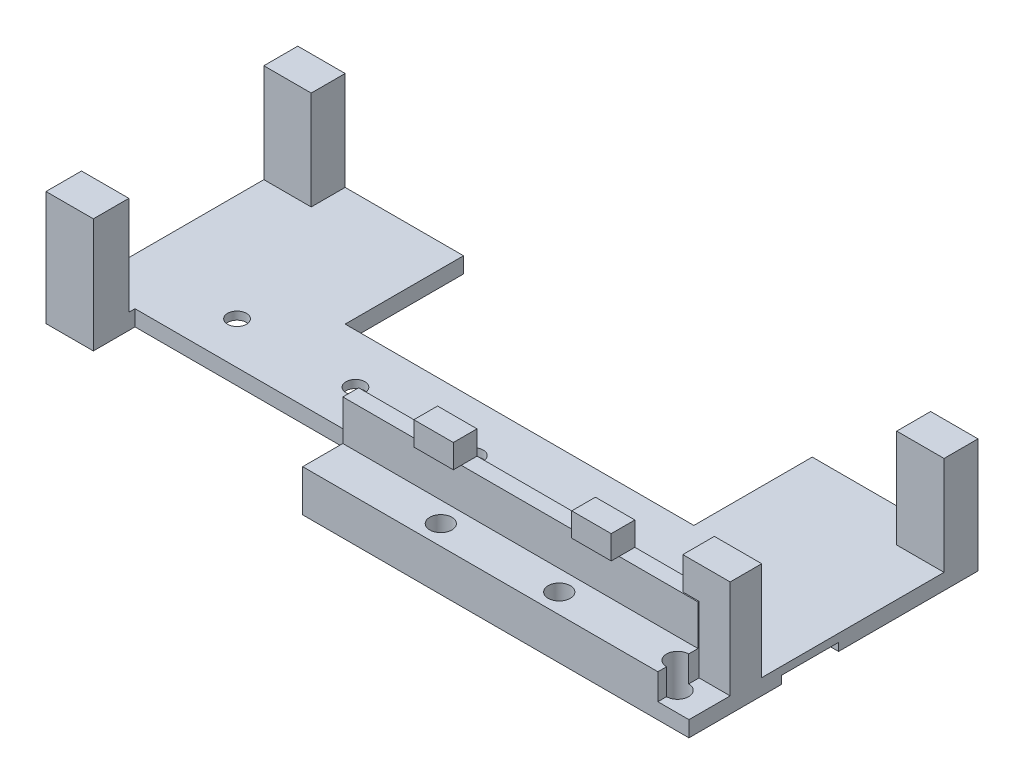
from build123d import *

# Parameters (mm, degrees)
EXTRUDE_1_DEPTH           = 2
CUT_EXTRUDE_1_DEPTH       = 2
SKETCH_3_W                = 3
SKETCH_3_H                = 3
EXTRUDE_2_DEPTH           = 12
EXTRUDE_3_DEPTH           = 12
SKETCH_5_R                = 0.75
CUT_EXTRUDE_2_DEPTH       = 12
SKETCH_6_R                = 0.75
CUT_EXTRUDE_3_DEPTH       = 12
SKETCH_7_W                = 26
SKETCH_7_H                = 60
EXTRUDE_4_DEPTH           = 2
SKETCH_8_W                = 3.705700703
SKETCH_8_H                = 4.457179677
SKETCH_8_W_2              = 1.523965484
SKETCH_8_H_2              = 4.5
EXTRUDE_5_DEPTH           = 14.4
SKETCH_9_R                = 0.95
CUT_EXTRUDE_4_DEPTH       = 14.4
SKETCH_10_W               = 26
SKETCH_10_H               = 8
EXTRUDE_6_DEPTH           = 2
SKETCH_11_W               = 4.5
SKETCH_11_H               = 4.5
EXTRUDE_7_DEPTH           = 14.4
SKETCH_12_R               = 0.95
CUT_EXTRUDE_5_DEPTH       = 14.4
FILLET_2_R                = 1
SKETCH_13_W               = 4.5
SKETCH_13_H               = 4.5
CUT_EXTRUDE_6_DEPTH       = 14.4
SKETCH_15_R               = 1.75
CUT_EXTRUDE_8_DEPTH       = 12
SKETCH_14_W               = 3
SKETCH_14_H               = 3
CUT_EXTRUDE_9_DEPTH       = 12
SKETCH_16_W               = 4.5
SKETCH_16_H               = 4.5
SKETCH_16_W_2             = 4.196061315
EXTRUDE_8_DEPTH           = 14.4
CUT_EXTRUDE_11_DEPTH      = 10
SKETCH_19_R               = 0.95
CUT_EXTRUDE_12_DEPTH      = 10
FILLET_3_R                = 1
SKETCH_21_W               = 2.552667246
SKETCH_21_H               = 4.5
EXTRUDE_9_DEPTH           = 14.4
CUT_EXTRUDE_14_DEPTH      = 79.074165065
CUT_EXTRUDE_14_DEPTH_BACK = 79.074165065
SKETCH_9_3_R              = 0.95
EXTRUDE_10_DEPTH          = 2
SKETCH_31_W               = 30
SKETCH_31_H               = 16
EXTRUDE_13_DEPTH          = 2
SKETCH_36_W               = 30
SKETCH_36_H               = 4
CUT_EXTRUDE_21_DEPTH      = 10
SKETCH_38_W               = 72
SKETCH_38_H               = 73.901085024
CUT_EXTRUDE_22_DEPTH      = 36.5
SKETCH_39_W               = 4.5
SKETCH_39_H               = 4.5
CUT_EXTRUDE_23_DEPTH      = 14.4
SKETCH_62_W               = 10
SKETCH_62_H               = 2
EXTRUDE_22_DEPTH          = 11.717956628
SKETCH_40_W               = 50
SKETCH_40_H               = 7.2
CUT_EXTRUDE_24_DEPTH      = 1
SKETCH_41_R               = 1.2
CUT_EXTRUDE_25_DEPTH      = 89.212970365
SKETCH_44_W               = 9
SKETCH_44_H               = 47.717956628
EXTRUDE_15_DEPTH          = 2
SKETCH_47_W               = 14
SKETCH_47_H               = 7.2
CUT_EXTRUDE_29_DEPTH      = 1
SKETCH_48_W               = 7
SKETCH_48_H               = 47.717956628
EXTRUDE_17_DEPTH          = 2
SKETCH_54_W               = 88
SKETCH_54_H               = 7.2
CUT_EXTRUDE_32_DEPTH      = 1
SKETCH_56_W               = 88
SKETCH_56_H               = 0.717956628
CUT_EXTRUDE_34_DEPTH      = 10
SKETCH_63_W               = 48.226708388
SKETCH_63_H               = 2
EXTRUDE_23_DEPTH          = 10
SKETCH_65_W               = 45
SKETCH_65_H               = 2
EXTRUDE_24_DEPTH          = 8.4
SKETCH_66_W               = 5
SKETCH_66_H               = 3
EXTRUDE_25_DEPTH          = 3
SKETCH_67_W               = 45
SKETCH_67_H               = 3.29
EXTRUDE_26_DEPTH          = 5.084597618
SKETCH_68_R               = 1.4
CUT_EXTRUDE_35_DEPTH      = 8
CUT_EXTRUDE_36_DEPTH      = 97.788884386
CUT_EXTRUDE_36_DEPTH_BACK = 97.788884386
SKETCH_69_W               = 46
SKETCH_69_H               = 12
SKETCH_75_W               = 6
SKETCH_75_H               = 4.3
SKETCH_75_H_2             = 4.5
SKETCH_75_H_3             = 4
EXTRUDE_30_DEPTH          = 12.5
EXTRUDE_31_DEPTH          = 0.71
SKETCH_77_W               = 6
SKETCH_77_H               = 2
EXTRUDE_32_DEPTH          = 5.279303266
CUT_EXTRUDE_39_DEPTH      = 2.53
SKETCH_79_W               = 86.18
SKETCH_79_H               = 8.379303266
CUT_EXTRUDE_40_DEPTH      = 2
SKETCH_80_W               = 44.18
SKETCH_80_H               = 15
CUT_EXTRUDE_41_DEPTH      = 12.5


with BuildPart() as part:
    # 草图1 → 凸台-拉伸1 (new body)
    with BuildSketch(Plane(origin=(0, 0, 0), x_dir=(1, 0, 0), z_dir=(0, 1, 0))):
        with BuildLine():
            Line((5, 0), (31, 0))
            Line((31, 0), (31, -12.266105287))
            Line((31, -12.266105287), (17.561663747, -40))
            Line((17.561663747, -40), (-17.561663747, -40))
            Line((-17.561663747, -40), (-31, -12.266105287))
            Line((-31, -12.266105287), (-31, 0))
            Line((-31, 0), (-5, 0))
            Line((-5, 0), (-5, -5))
            ThreePointArc((-5, -5), (0, -10), (5, -5))
            Line((5, -5), (5, 0))
        make_face()
    extrude(amount=EXTRUDE_1_DEPTH)

    # 草图2 → 切除-拉伸1 (cut)
    with BuildSketch(Plane.XZ):
        Polygon((-31, 0), (-24.370648345, 19.60824232), (-13.013264916, 35.515995547), (-4.410164775, 40), (-17.561663747, 40), (-31, 12.266105287), align=None)
    cut_extrude_1 = extrude(amount=-CUT_EXTRUDE_1_DEPTH, mode=Mode.SUBTRACT)

    # 镜向1: 切除-拉伸1 across plane
    add(cut_extrude_1.mirror(Plane(origin=(0, 0, 0), x_dir=(0, 0, 1), z_dir=(1, 0, 0))), mode=Mode.SUBTRACT)

    # 草图3 → 凸台-拉伸2 (add)
    with BuildSketch(Plane(origin=(0, 2, 0), x_dir=(1, 0, 0), z_dir=(0, 1, 0))):
        with Locations((0.264476572, -30.687696452)):
            Rectangle(SKETCH_3_W, SKETCH_3_H)
    extrude(amount=EXTRUDE_2_DEPTH)

    # 草图4 → 凸台-拉伸3 (add)
    with BuildSketch(Plane(origin=(0, 2, 0), x_dir=(1, 0, 0), z_dir=(0, 1, 0))):
        Polygon((12.325065561, -24.884390537), (14.54097081, -22.857655099), (12.419650467, -20.736334755), (10.298330123, -22.857655099), align=None)
    extrude_3 = extrude(amount=EXTRUDE_3_DEPTH)

    # 草图5 → 切除-拉伸2 (cut)
    with BuildSketch(Plane.ZY.offset(1.235523428)):
        with Locations((30.687696452, 11.5)):
            Circle(SKETCH_5_R)
        with Locations((30.687696452, 4.5)):
            Circle(SKETCH_5_R)
    extrude(amount=-CUT_EXTRUDE_2_DEPTH, mode=Mode.SUBTRACT)

    # 草图6 → 切除-拉伸3 (cut)
    with BuildSketch(Plane(origin=(18.192824737, 0, 30.752149712), x_dir=(0.7071067811865495, 0, 0.7071067811865457), z_dir=(-0.7071067811865457, 0, 0.7071067811865495))):
        with Locations((-9.798264607, 11.5)):
            Circle(SKETCH_6_R)
        with Locations((-9.798264607, 4.5)):
            Circle(SKETCH_6_R)
    cut_extrude_3 = extrude(amount=-CUT_EXTRUDE_3_DEPTH, mode=Mode.SUBTRACT)

    # 镜向2: 凸台-拉伸3, 切除-拉伸3 across plane
    add(extrude_3.mirror(Plane(origin=(0, 0, 0), x_dir=(0, 0, 1), z_dir=(1, 0, 0))))
    add(cut_extrude_3.mirror(Plane(origin=(0, 0, 0), x_dir=(0, 0, 1), z_dir=(1, 0, 0))), mode=Mode.SUBTRACT)

    # 草图7 → 凸台-拉伸4 (add)
    with BuildSketch(Plane(origin=(0, 2, 0), x_dir=(1, 0, 0), z_dir=(0, 1, 0))):
        with Locations((-18, 30)):
            Rectangle(SKETCH_7_W, SKETCH_7_H)
        with Locations((18, 30)):
            Rectangle(SKETCH_7_W, SKETCH_7_H)
    extrude(amount=-EXTRUDE_4_DEPTH)

    # 草图8 → 凸台-拉伸5 (add)
    with BuildSketch(Plane(origin=(0, 2, 0), x_dir=(1, 0, 0), z_dir=(0, 1, 0))):
        with Locations((28.776217622, 3.180021452)):
            Rectangle(SKETCH_8_W, SKETCH_8_H)
        with Locations((27.685350012, 30.55861129)):
            Rectangle(SKETCH_8_W_2, SKETCH_8_H_2)
    extrude_5 = extrude(amount=EXTRUDE_5_DEPTH)

    # 草图9 → 切除-拉伸4 (cut)
    with BuildSketch(Plane(origin=(31, 0, 0), x_dir=(0, 0, -1), z_dir=(1, 0, 0))):
        with Locations((3.00861129, 8.2)):
            Circle(SKETCH_9_R)
        with Locations((30.70861129, 8.2)):
            Circle(SKETCH_9_R)
    cut_extrude_4 = extrude(amount=-CUT_EXTRUDE_4_DEPTH, mode=Mode.SUBTRACT)

    # 镜向3: 凸台-拉伸5, 切除-拉伸4 across plane
    add(extrude_5.mirror(Plane(origin=(0, 0, 0), x_dir=(0, 0, 1), z_dir=(1, 0, 0))))
    add(cut_extrude_4.mirror(Plane(origin=(0, 0, 0), x_dir=(0, 0, 1), z_dir=(1, 0, 0))), mode=Mode.SUBTRACT)

    # 草图10 → 凸台-拉伸6 (add)
    with BuildSketch(Plane(origin=(0, 2, 0), x_dir=(1, 0, 0), z_dir=(0, 1, 0))):
        with Locations((-18, 64)):
            Rectangle(SKETCH_10_W, SKETCH_10_H)
        Polygon((5, 60), (5, 68), (30.798641436, 68), (31, 60), align=None)
    extrude(amount=-EXTRUDE_6_DEPTH)

    # 草图11 → 凸台-拉伸7 (add)
    with BuildSketch(Plane(origin=(0, 2, 0), x_dir=(1, 0, 0), z_dir=(0, 1, 0))):
        with Locations((18.529999999, 37.05861129)):
            Rectangle(SKETCH_11_W, SKETCH_11_H)
        with Locations((18.529999999, 64.45861129)):
            Rectangle(SKETCH_11_W, SKETCH_11_H)
    extrude(amount=EXTRUDE_7_DEPTH)

    # 草图12 → 切除-拉伸5 (cut)
    with BuildSketch(Plane.ZY.offset(-16.279999999)):
        with Locations((-36.90861129, 8.2)):
            Circle(SKETCH_12_R)
        with Locations((-64.60861129, 8.2)):
            Circle(SKETCH_12_R)
    extrude(amount=-CUT_EXTRUDE_5_DEPTH, mode=Mode.SUBTRACT)

    # 圆角2
    fillet_2_edges = [part.edges().sort_by_distance(p)[0] for p in [
        (26.92336727, 9.2, -5.40861129),
        (26.92336727, 9.2, -28.30861129),
        (-26.92336727, 9.2, -5.40861129),
        (-26.92336727, 9.2, -28.30861129),
        (16.279999999, 9.2, -39.30861129),
        (16.279999999, 9.2, -62.20861129),
    ]]
    fillet(fillet_2_edges, radius=FILLET_2_R)

    # 草图13 → 切除-拉伸6 (cut)
    with BuildSketch(Plane(origin=(0, 16.4, 0), x_dir=(1, 0, 0), z_dir=(0, 1, 0))):
        with Locations((18.529999999, 37.05861129)):
            Rectangle(SKETCH_13_W, SKETCH_13_H)
        with Locations((18.529999999, 64.45861129)):
            Rectangle(SKETCH_13_W, SKETCH_13_H)
    extrude(amount=-CUT_EXTRUDE_6_DEPTH, mode=Mode.SUBTRACT)

    # 草图15 → 切除-拉伸8 (cut)
    with BuildSketch(Plane(origin=(0, 2, 0), x_dir=(1, 0, 0), z_dir=(0, 1, 0))):
        with Locations(Location((-6.235523428, -30.687696452, 0), (0, 0, 270))):
            Circle(SKETCH_15_R)
        with Locations(Location((6.764476572, -30.687696452, 0), (0, 0, 270))):
            Circle(SKETCH_15_R)
    extrude(amount=-CUT_EXTRUDE_8_DEPTH, mode=Mode.SUBTRACT)

    # 草图14 → 切除-拉伸9 (cut)
    with BuildSketch(Plane(origin=(0, 14, 0), x_dir=(1, 0, 0), z_dir=(0, 1, 0))):
        with Locations((0.264476572, -30.687696452)):
            Rectangle(SKETCH_14_W, SKETCH_14_H)
    extrude(amount=-CUT_EXTRUDE_9_DEPTH, mode=Mode.SUBTRACT)

    # 草图16 → 凸台-拉伸8 (add)
    with BuildSketch(Plane.XZ):
        with Locations((-18.720947438, -42.276567918)):
            Rectangle(SKETCH_16_W, SKETCH_16_H)
        with Locations((-18.568978096, -14.876567918)):
            Rectangle(SKETCH_16_W_2, SKETCH_16_H)
    extrude(amount=EXTRUDE_8_DEPTH)

    # 草图17 → 切除-拉伸11 (cut)
    with BuildSketch(Plane.XZ):
        Polygon((-20.970947438, -44.526567918), (-31, -44.526567918), (-37.437571986, -44.526567918), (-37.437571986, -68), (-31, -68), (30.798641436, -68), (38.694931003, -68), (38.694931003, -44.526567918), (31, -44.526567918), align=None)
    extrude(amount=-CUT_EXTRUDE_11_DEPTH, mode=Mode.SUBTRACT)

    # 草图19 → 切除-拉伸12 (cut)
    with BuildSketch(Plane(origin=(-16.470947438, 0, 0), x_dir=(0, 0, -1), z_dir=(1, 0, 0))):
        with Locations((14.726567918, -6.2)):
            Circle(SKETCH_19_R)
        with Locations((42.426567918, -6.2)):
            Circle(SKETCH_19_R)
    extrude(amount=-CUT_EXTRUDE_12_DEPTH, mode=Mode.SUBTRACT)

    # 圆角3
    fillet_3_edges = [part.edges().sort_by_distance(p)[0] for p in [
        (-16.470947438, -7.2, -40.026567918),
        (-16.470947438, -7.2, -17.126567918),
    ]]
    fillet(fillet_3_edges, radius=FILLET_3_R)

    # 草图21 → 凸台-拉伸9 (add)
    with BuildSketch(Plane(origin=(0, 2, 0), x_dir=(1, 0, 0), z_dir=(0, 1, 0))):
        with Locations((-29.723666377, 30.55861129)):
            Rectangle(SKETCH_21_W, SKETCH_21_H)
        with Locations((29.723666377, 30.55861129)):
            Rectangle(SKETCH_21_W, SKETCH_21_H)
    extrude(amount=EXTRUDE_9_DEPTH)

    # 草图9<3> → 切除-拉伸14 (cut, two sides: drawn at the far end of the back side and taken through both)
    with BuildSketch(Plane(origin=(31, 0, 0), x_dir=(0, 0, -1), z_dir=(1, 0, 0)).offset(-CUT_EXTRUDE_14_DEPTH_BACK)):
        with Locations((3.00861129, 8.2)):
            Circle(SKETCH_9_3_R)
        with Locations((30.70861129, 8.2)):
            Circle(SKETCH_9_3_R)
    extrude(amount=CUT_EXTRUDE_14_DEPTH + CUT_EXTRUDE_14_DEPTH_BACK, mode=Mode.SUBTRACT)

    # 草图22 → 凸台-拉伸10 (add)
    with BuildSketch(Plane(origin=(0, 2, 0), x_dir=(1, 0, 0), z_dir=(0, 1, 0))):
        Polygon((31, 68.526567918), (-31, 68.526567918), (-36, 68.526567918), (-36, 32.80861129), (-31, 32.80861129), (-31, 44.526567918), (31, 44.526567918), (31, 32.80861129), (36, 32.80861129), (36, 68.526567918), align=None)
    extrude(amount=-EXTRUDE_10_DEPTH)

    # 草图31 → 凸台-拉伸13 (add)
    with BuildSketch(Plane(origin=(0, 2, 0), x_dir=(1, 0, 0), z_dir=(0, 1, 0))):
        with Locations((21, 76.526567918)):
            Rectangle(SKETCH_31_W, SKETCH_31_H)
    extrude(amount=-EXTRUDE_13_DEPTH)

    # 草图36 → 切除-拉伸21 (cut)
    with BuildSketch(Plane.XZ):
        with Locations((21, -82.526567918)):
            Rectangle(SKETCH_36_W, SKETCH_36_H)
    extrude(amount=-CUT_EXTRUDE_21_DEPTH, mode=Mode.SUBTRACT)

    # 草图38 → 切除-拉伸22 (cut, symmetric)
    with BuildSketch(Plane(origin=(0, 2, 0), x_dir=(1, 0, 0), z_dir=(0, 1, 0))):
        with Locations((0, -4.141931222)):
            Rectangle(SKETCH_38_W, SKETCH_38_H)
    extrude(amount=CUT_EXTRUDE_22_DEPTH, both=True, mode=Mode.SUBTRACT)

    # 草图39 → 切除-拉伸23 (cut)
    with BuildSketch(Plane.XZ.offset(14.4)):
        with Locations((-18.720947438, -42.276567918)):
            Rectangle(SKETCH_39_W, SKETCH_39_H)
    extrude(amount=-CUT_EXTRUDE_23_DEPTH, mode=Mode.SUBTRACT)

    # 草图62 → 凸台-拉伸22 (add)
    with BuildSketch(Plane.XY.offset(-44.526567918)):
        with Locations((0, 1)):
            Rectangle(SKETCH_62_W, SKETCH_62_H)
    extrude(amount=EXTRUDE_22_DEPTH)

    # 草图40 → 切除-拉伸24 (cut)
    with BuildSketch(Plane.XZ):
        with Locations((0, -38.881165536)):
            Rectangle(SKETCH_40_W, SKETCH_40_H)
    extrude(amount=-CUT_EXTRUDE_24_DEPTH, mode=Mode.SUBTRACT)

    # 草图41 → 切除-拉伸25 (cut, through all)
    with BuildSketch(Plane.XZ.offset(-1)):
        with Locations(Location((-19.9, -38.881165536, 0), (0, 0, 270))):
            Circle(SKETCH_41_R)
        with Locations(Location((-4.9, -38.881165536, 0), (0, 0, 270))):
            Circle(SKETCH_41_R)
        with Locations(Location((10.1, -38.881165536, 0), (0, 0, 270))):
            Circle(SKETCH_41_R)
        with Locations(Location((25.1, -38.881165536, 0), (0, 0, 270))):
            Circle(SKETCH_41_R)
    extrude(amount=-CUT_EXTRUDE_25_DEPTH, mode=Mode.SUBTRACT)

    # 草图44 → 凸台-拉伸15 (add)
    with BuildSketch(Plane(origin=(0, 2, 0), x_dir=(1, 0, 0), z_dir=(0, 1, 0))):
        with Locations((40.5, 56.667589604)):
            Rectangle(SKETCH_44_W, SKETCH_44_H)
    extrude(amount=-EXTRUDE_15_DEPTH)

    # 草图47 → 切除-拉伸29 (cut)
    with BuildSketch(Plane.XZ):
        with Locations((32, -38.881165536)):
            Rectangle(SKETCH_47_W, SKETCH_47_H)
    extrude(amount=-CUT_EXTRUDE_29_DEPTH, mode=Mode.SUBTRACT)

    # 草图48 → 凸台-拉伸17 (add)
    with BuildSketch(Plane(origin=(0, 2, 0), x_dir=(1, 0, 0), z_dir=(0, 1, 0))):
        with Locations((48.5, 56.667589604)):
            Rectangle(SKETCH_48_W, SKETCH_48_H)
    extrude(amount=-EXTRUDE_17_DEPTH)

    # 草图54 → 切除-拉伸32 (cut)
    with BuildSketch(Plane.XZ):
        with Locations((8, -38.881165536)):
            Rectangle(SKETCH_54_W, SKETCH_54_H)
    extrude(amount=-CUT_EXTRUDE_32_DEPTH, mode=Mode.SUBTRACT)

    # 草图56 → 切除-拉伸34 (cut)
    with BuildSketch(Plane.XZ):
        with Locations((8, -33.167589604)):
            Rectangle(SKETCH_56_W, SKETCH_56_H)
    extrude(amount=-CUT_EXTRUDE_34_DEPTH, mode=Mode.SUBTRACT)

    # 草图63 → 凸台-拉伸23 (add)
    with BuildSketch(Plane.XY.offset(-33.526567918)):
        with Locations((27.886645806, 1)):
            Rectangle(SKETCH_63_W, SKETCH_63_H)
    extrude(amount=EXTRUDE_23_DEPTH)

    # 草图65 → 凸台-拉伸24 (add)
    with BuildSketch(Plane(origin=(0, 2, 0), x_dir=(1, 0, 0), z_dir=(0, 1, 0))):
        with Locations((26.273291612, 29.611165536)):
            Rectangle(SKETCH_65_W, SKETCH_65_H)
    extrude(amount=EXTRUDE_24_DEPTH)

    # 草图66 → 凸台-拉伸25 (add)
    with BuildSketch(Plane(origin=(0, 10.4, 0), x_dir=(1, 0, 0), z_dir=(0, 1, 0))):
        with Locations((36.273291612, 29.111165536)):
            Rectangle(SKETCH_66_W, SKETCH_66_H)
        with Locations((16.273291612, 29.111165536)):
            Rectangle(SKETCH_66_W, SKETCH_66_H)
    extrude(amount=EXTRUDE_25_DEPTH)

    # 草图67 → 凸台-拉伸26 (add)
    with BuildSketch(Plane.XY.offset(-28.611165536)):
        with Locations((26.273291612, 3.645)):
            Rectangle(SKETCH_67_W, SKETCH_67_H)
    extrude(amount=EXTRUDE_26_DEPTH)

    # 草图68 → 切除-拉伸35 (cut)
    with BuildSketch(Plane(origin=(0, 5.29, 0), x_dir=(1, 0, 0), z_dir=(0, 1, 0))):
        with Locations(Location((33.773291612, 26.026567918, 0), (0, 0, 270))):
            Circle(SKETCH_68_R)
        with Locations(Location((18.773291612, 26.026567918, 0), (0, 0, 270))):
            Circle(SKETCH_68_R)
        with Locations(Location((48.773291612, 26.026567918, 0), (0, 0, 270))):
            Circle(SKETCH_68_R)
    extrude(amount=-CUT_EXTRUDE_35_DEPTH, mode=Mode.SUBTRACT)

    # 草图69 → 切除-拉伸36 (cut, two sides: drawn at the far end of the back side and taken through both)
    with BuildSketch(Plane.XZ.offset(-CUT_EXTRUDE_36_DEPTH_BACK)):
        with Locations((29, -74.526567918)):
            Rectangle(SKETCH_69_W, SKETCH_69_H)
    extrude(amount=CUT_EXTRUDE_36_DEPTH + CUT_EXTRUDE_36_DEPTH_BACK, mode=Mode.SUBTRACT)

    # 草图75 → 凸台-拉伸30 (add)
    with BuildSketch(Plane(origin=(0, 2, 0), x_dir=(1, 0, 0), z_dir=(0, 1, 0))):
        with Locations((-30.47, 57.997264652)):
            Rectangle(SKETCH_75_W, SKETCH_75_H)
        with Locations((-30.47, 30.497264652)):
            Rectangle(SKETCH_75_W, SKETCH_75_H_2)
        with Locations((49.71, 30.747264652)):
            Rectangle(SKETCH_75_W, SKETCH_75_H_3)
        with Locations((49.71, 57.997264652)):
            Rectangle(SKETCH_75_W, SKETCH_75_H)
    extrude(amount=EXTRUDE_30_DEPTH)


with BuildPart() as extrude_30_piece_1:
    # of the separate pieces the step leaves, piece 1, a body of its own (extrude_30_pieces)
    add(part.part.solids().sort_by_distance((3.773291612, 0, -33.526567918))[0])

    # 草图76 → 凸台-拉伸31 (add)
    with BuildSketch(Plane(origin=(52, 0, 0), x_dir=(0, 0, -1), z_dir=(1, 0, 0))):
        Polygon((68.526567918, 0), (68.526567918, 2), (60.147264652, 2), (55.847264652, 2), (32.747264652, 2), (28.747264652, 2), (23.526567918, 2), (23.526567918, 0), (35.281165536, 0), (35.281165536, 1), (42.481165536, 1), (42.481165536, 0), align=None)
    extrude(amount=EXTRUDE_31_DEPTH)



with BuildPart() as extrude_30_piece_2:
    # of the separate pieces the step leaves, piece 2, a body of its own (extrude_30_pieces)
    add(part.part.solids().sort_by_distance((-33.47, 2, -32.747264652))[0])


with BuildPart() as extrude_30_piece_1_1:
    add(extrude_30_piece_1.part)

    add(extrude_30_piece_2.part)  # 凸台-拉伸32 merges 凸台-拉伸30 piece 2
    # 草图77 → 凸台-拉伸32 (add)
    with BuildSketch(Plane.XY.offset(-33.526567918)):
        with Locations((-30.47, 1)):
            Rectangle(SKETCH_77_W, SKETCH_77_H)
    extrude(amount=EXTRUDE_32_DEPTH)

    # 草图78 → 切除-拉伸39 (cut)
    with BuildSketch(Plane.ZY.offset(36)):
        Polygon((-33.526567918, 0), (-33.526567918, 2), (-68.526567918, 2), (-68.526567918, 0), (-42.481165536, 0), (-42.481165536, 1), (-35.281165536, 1), (-35.281165536, 0), align=None)
    extrude(amount=-CUT_EXTRUDE_39_DEPTH, mode=Mode.SUBTRACT)

    # 草图79 → 切除-拉伸40 (cut)
    with BuildSketch(Plane(origin=(0, 2, 0), x_dir=(1, 0, 0), z_dir=(0, 1, 0))):
        with Locations((9.62, 64.336916285)):
            Rectangle(SKETCH_79_W, SKETCH_79_H)
    extrude(amount=-CUT_EXTRUDE_40_DEPTH, mode=Mode.SUBTRACT)

    # 草图80 → 切除-拉伸41 (cut)
    with BuildSketch(Plane(origin=(0, 2, 0), x_dir=(1, 0, 0), z_dir=(0, 1, 0))):
        with Locations((9.62, 52.647264652)):
            Rectangle(SKETCH_80_W, SKETCH_80_H)
    extrude(amount=-CUT_EXTRUDE_41_DEPTH, mode=Mode.SUBTRACT)


solid = extrude_30_piece_1_1.part
